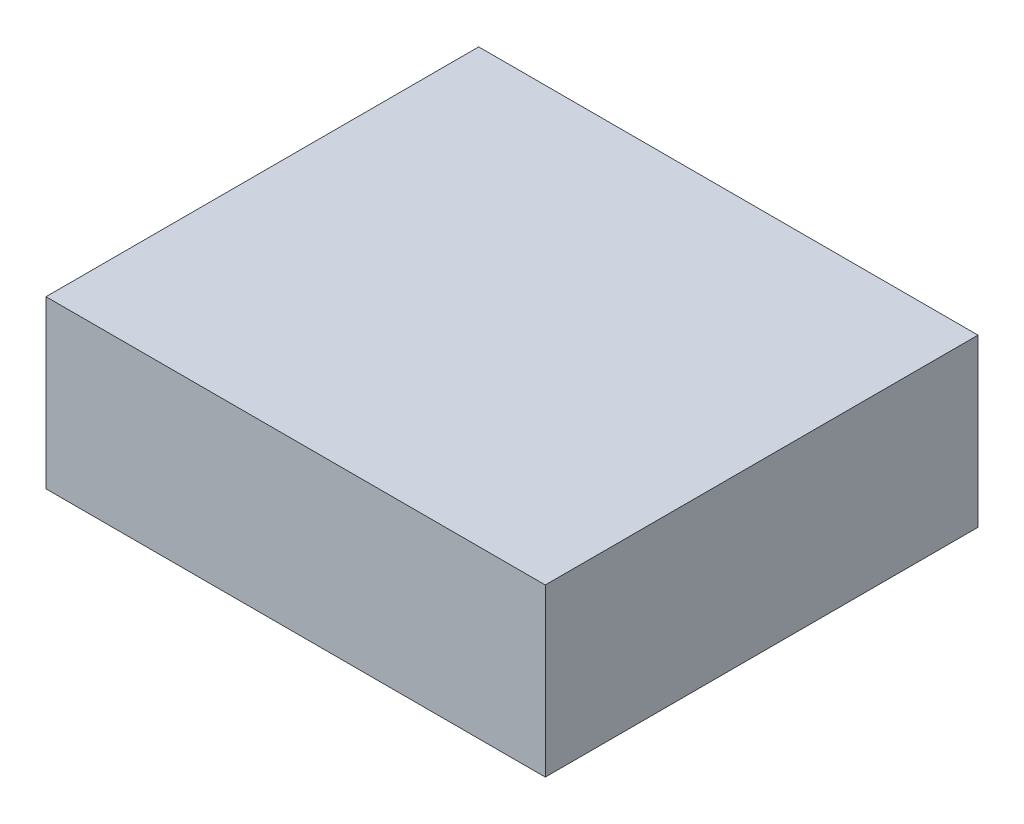
from build123d import *

# Parameters (mm, degrees)
SKETCH1_W           = 60
SKETCH1_H           = 52
BOSS_EXTRUDE1_DEPTH = 20


with BuildPart() as part:
    # Sketch1 → Boss-Extrude1 (new body)
    with BuildSketch(Plane(origin=(0, 0, 0), x_dir=(1, 0, 0), z_dir=(0, 1, 0))):
        Rectangle(SKETCH1_W, SKETCH1_H)
    extrude(amount=BOSS_EXTRUDE1_DEPTH)


solid = part.part
